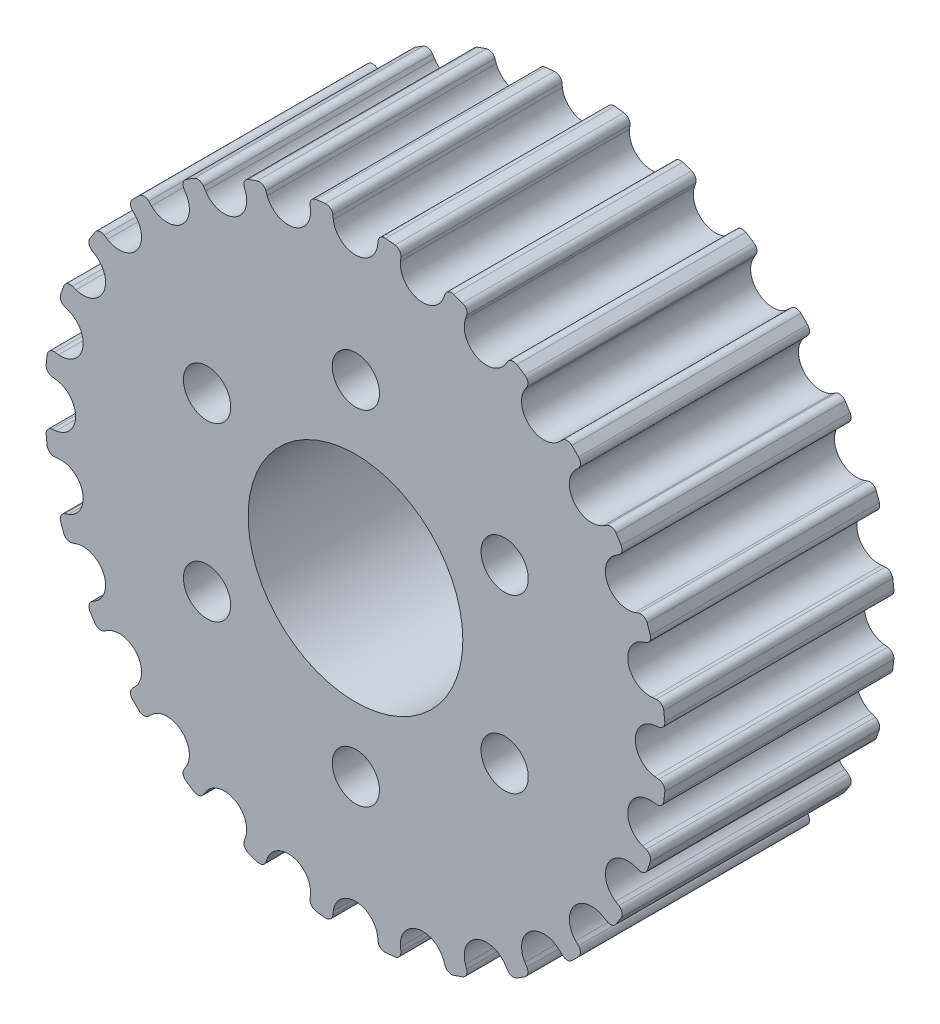
from build123d import *

# Parameters (mm, degrees)
SKETCH_1_R          = 7.5
EXTRUDE_1_DEPTH     = 16
SKETCH_9_R          = 1.65
CUT_EXTRUDE_2_DEPTH = 16
SKETCH_7_R          = 1.65
CUT_EXTRUDE_1_DEPTH = 41


with BuildPart() as part:
    # 草图1 → 凸台-拉伸1 (new body)
    with BuildSketch(Plane.XY):
        with BuildLine():
            Line((1.554033471, 21.184411781), (1.521048557, 20.915771216))
            ThreePointArc((1.521048557, 20.915771216), (-0.027323439, 19.545887392), (-1.575695436, 20.915771216))
            Line((-1.575695436, 20.915771216), (-1.608680349, 21.184411781))
            ThreePointArc((-1.608680349, 21.184411781), (-1.784864491, 21.500423691), (-2.131632272, 21.603653945))
            ThreePointArc((-2.131632272, 21.603653945), (-2.457848286, 21.569392044), (-2.783509374, 21.530205035))
            ThreePointArc((-2.783509374, 21.530205035), (-3.09861207, 21.352399889), (-3.200059642, 21.005106398))
            Line((-3.200059642, 21.005106398), (-3.172439406, 20.735861379))
            ThreePointArc((-3.172439406, 20.735861379), (-4.377162656, 19.055778219), (-6.191541562, 20.046771013))
            Line((-6.191541562, 20.046771013), (-6.283477625, 20.301336364))
            ThreePointArc((-6.283477625, 20.301336364), (-6.525563727, 20.570220536), (-6.886608208, 20.593699501))
            ThreePointArc((-6.886608208, 20.593699501), (-7.197021316, 20.487706726), (-7.505797471, 20.377035808))
            ThreePointArc((-7.505797471, 20.377035808), (-7.773434517, 20.133571662), (-7.795058515, 19.772411335))
            Line((-7.795058515, 19.772411335), (-7.708218122, 19.516062931))
            ThreePointArc((-7.708218122, 19.516062931), (-8.508882771, 17.610026822), (-10.498288052, 18.172436068))
            Line((-10.498288052, 18.172436068), (-10.644565205, 18.400161236))
            ThreePointArc((-10.644565205, 18.400161236), (-10.940414061, 18.608434695), (-11.297630964, 18.550985038))
            ThreePointArc((-11.297630964, 18.550985038), (-11.576675756, 18.378576309), (-11.853083652, 18.201970983))
            ThreePointArc((-11.853083652, 18.201970983), (-12.059834609, 17.905056146), (-12.000550715, 17.54813907))
            Line((-12.000550715, 17.54813907), (-11.858844707, 17.317541662))
            ThreePointArc((-11.858844707, 17.317541662), (-12.215302086, 15.281129211), (-14.279976653, 15.386753363))
            Line((-14.279976653, 15.386753363), (-14.47325995, 15.576219257))
            ThreePointArc((-14.47325995, 15.576219257), (-14.808036462, 15.713438301), (-15.14351344, 15.577940788))
            ThreePointArc((-15.14351344, 15.577940788), (-15.377197445, 15.347761398), (-15.607376836, 15.114077393))
            ThreePointArc((-15.607376836, 15.114077393), (-15.742874348, 14.778600415), (-15.605655304, 14.443823903))
            Line((-15.605655304, 14.443823903), (-15.41618941, 14.250540606))
            ThreePointArc((-15.41618941, 14.250540606), (-15.310565258, 12.185866039), (-17.346977709, 11.829408659))
            Line((-17.346977709, 11.829408659), (-17.577575117, 11.971114668))
            ThreePointArc((-17.577575117, 11.971114668), (-17.934492193, 12.030398562), (-18.23140703, 11.823647605))
            ThreePointArc((-18.23140703, 11.823647605), (-18.408012356, 11.547239709), (-18.580421086, 11.268194917))
            ThreePointArc((-18.580421086, 11.268194917), (-18.637870742, 10.910978014), (-18.429597284, 10.615129158))
            Line((-18.429597284, 10.615129158), (-18.201872116, 10.468852005))
            ThreePointArc((-18.201872116, 10.468852005), (-17.639462869, 8.479446724), (-19.545498979, 7.678782075))
            Line((-19.545498979, 7.678782075), (-19.801847382, 7.765622467))
            ThreePointArc((-19.801847382, 7.765622467), (-20.163007709, 7.74399847), (-20.406471855, 7.476361423))
            ThreePointArc((-20.406471855, 7.476361423), (-20.517142773, 7.167585269), (-20.623135549, 6.857172161))
            ThreePointArc((-20.623135549, 6.857172161), (-20.599656583, 6.49612768), (-20.330772412, 6.254041577))
            Line((-20.330772412, 6.254041577), (-20.07620706, 6.162105515))
            ThreePointArc((-20.07620706, 6.162105515), (-19.085214266, 4.347726609), (-20.765297426, 3.143003359))
            Line((-20.765297426, 3.143003359), (-21.034542445, 3.170623595))
            ThreePointArc((-21.034542445, 3.170623595), (-21.381835936, 3.069176023), (-21.559641082, 2.754073327))
            ThreePointArc((-21.559641082, 2.754073327), (-21.598828091, 2.428412239), (-21.633089992, 2.102196225))
            ThreePointArc((-21.633089992, 2.102196225), (-21.529859738, 1.755428444), (-21.213847828, 1.579244302))
            Line((-21.213847828, 1.579244302), (-20.945207263, 1.546259388))
            ThreePointArc((-20.945207263, 1.546259388), (-19.575323439, -0.002112608), (-20.945207263, -1.550484605))
            Line((-20.945207263, -1.550484605), (-21.213847828, -1.583469519))
            ThreePointArc((-21.213847828, -1.583469519), (-21.529859738, -1.75965366), (-21.633089992, -2.106421441))
            ThreePointArc((-21.633089992, -2.106421441), (-21.598828091, -2.432637455), (-21.559641082, -2.758298543))
            ThreePointArc((-21.559641082, -2.758298543), (-21.381835936, -3.073401239), (-21.034542445, -3.174848812))
            Line((-21.034542445, -3.174848812), (-20.765297426, -3.147228575))
            ThreePointArc((-20.765297426, -3.147228575), (-19.085214266, -4.351951825), (-20.07620706, -6.166330731))
            Line((-20.07620706, -6.166330731), (-20.330772412, -6.258266794))
            ThreePointArc((-20.330772412, -6.258266794), (-20.599656583, -6.500352897), (-20.623135549, -6.861397377))
            ThreePointArc((-20.623135549, -6.861397377), (-20.517142773, -7.171810485), (-20.406471855, -7.48058664))
            ThreePointArc((-20.406471855, -7.48058664), (-20.163007709, -7.748223686), (-19.801847382, -7.769847684))
            Line((-19.801847382, -7.769847684), (-19.545498979, -7.683007291))
            ThreePointArc((-19.545498979, -7.683007291), (-17.639462869, -8.48367194), (-18.201872116, -10.473077221))
            Line((-18.201872116, -10.473077221), (-18.429597284, -10.619354374))
            ThreePointArc((-18.429597284, -10.619354374), (-18.637870742, -10.91520323), (-18.580421086, -11.272420133))
            ThreePointArc((-18.580421086, -11.272420133), (-18.408012356, -11.551464925), (-18.23140703, -11.827872821))
            ThreePointArc((-18.23140703, -11.827872821), (-17.934492193, -12.034623778), (-17.577575117, -11.975339884))
            Line((-17.577575117, -11.975339884), (-17.346977709, -11.833633876))
            ThreePointArc((-17.346977709, -11.833633876), (-15.310565258, -12.190091255), (-15.41618941, -14.254765823))
            Line((-15.41618941, -14.254765823), (-15.605655304, -14.448049119))
            ThreePointArc((-15.605655304, -14.448049119), (-15.742874348, -14.782825631), (-15.607376836, -15.11830261))
            ThreePointArc((-15.607376836, -15.11830261), (-15.377197445, -15.351986614), (-15.14351344, -15.582166005))
            ThreePointArc((-15.14351344, -15.582166005), (-14.808036462, -15.717663517), (-14.47325995, -15.580444473))
            Line((-14.47325995, -15.580444473), (-14.279976653, -15.390978579))
            ThreePointArc((-14.279976653, -15.390978579), (-12.215302086, -15.285354427), (-11.858844707, -17.321766878))
            Line((-11.858844707, -17.321766878), (-12.000550715, -17.552364287))
            ThreePointArc((-12.000550715, -17.552364287), (-12.059834609, -17.909281362), (-11.853083652, -18.206196199))
            ThreePointArc((-11.853083652, -18.206196199), (-11.576675756, -18.382801525), (-11.297630964, -18.555210255))
            ThreePointArc((-11.297630964, -18.555210255), (-10.940414061, -18.612659911), (-10.644565205, -18.404386453))
            Line((-10.644565205, -18.404386453), (-10.498288052, -18.176661285))
            ThreePointArc((-10.498288052, -18.176661285), (-8.508882771, -17.614252038), (-7.708218122, -19.520288148))
            Line((-7.708218122, -19.520288148), (-7.795058515, -19.776636551))
            ThreePointArc((-7.795058515, -19.776636551), (-7.773434517, -20.137796878), (-7.505797471, -20.381261024))
            ThreePointArc((-7.505797471, -20.381261024), (-7.197021316, -20.491931943), (-6.886608208, -20.597924718))
            ThreePointArc((-6.886608208, -20.597924718), (-6.525563727, -20.574445752), (-6.283477625, -20.305561581))
            Line((-6.283477625, -20.305561581), (-6.191541562, -20.050996229))
            ThreePointArc((-6.191541562, -20.050996229), (-4.377162656, -19.060003436), (-3.172439406, -20.740086595))
            Line((-3.172439406, -20.740086595), (-3.200059642, -21.009331614))
            ThreePointArc((-3.200059642, -21.009331614), (-3.09861207, -21.356625105), (-2.783509374, -21.534430251))
            ThreePointArc((-2.783509374, -21.534430251), (-2.457848286, -21.573617261), (-2.131632272, -21.607879161))
            ThreePointArc((-2.131632272, -21.607879161), (-1.784864491, -21.504648907), (-1.608680349, -21.188636997))
            Line((-1.608680349, -21.188636997), (-1.575695436, -20.919996432))
            ThreePointArc((-1.575695436, -20.919996432), (-0.027323439, -19.550112608), (1.521048557, -20.919996432))
            Line((1.521048557, -20.919996432), (1.554033471, -21.188636997))
            ThreePointArc((1.554033471, -21.188636997), (1.730217613, -21.504648907), (2.076985394, -21.607879161))
            ThreePointArc((2.076985394, -21.607879161), (2.403201408, -21.573617261), (2.728862496, -21.534430251))
            ThreePointArc((2.728862496, -21.534430251), (3.043965192, -21.356625105), (3.145412764, -21.009331614))
            Line((3.145412764, -21.009331614), (3.117792528, -20.740086595))
            ThreePointArc((3.117792528, -20.740086595), (4.322515778, -19.060003436), (6.136894684, -20.050996229))
            Line((6.136894684, -20.050996229), (6.228830746, -20.305561581))
            ThreePointArc((6.228830746, -20.305561581), (6.470916849, -20.574445752), (6.83196133, -20.597924718))
            ThreePointArc((6.83196133, -20.597924718), (7.142374438, -20.491931943), (7.451150593, -20.381261024))
            ThreePointArc((7.451150593, -20.381261024), (7.718787639, -20.137796878), (7.740411637, -19.776636551))
            Line((7.740411637, -19.776636551), (7.653571244, -19.520288148))
            ThreePointArc((7.653571244, -19.520288148), (8.454235893, -17.614252038), (10.443641174, -18.176661285))
            Line((10.443641174, -18.176661285), (10.589918327, -18.404386453))
            ThreePointArc((10.589918327, -18.404386453), (10.885767183, -18.612659911), (11.242984086, -18.555210255))
            ThreePointArc((11.242984086, -18.555210255), (11.522028878, -18.382801525), (11.798436774, -18.206196199))
            ThreePointArc((11.798436774, -18.206196199), (12.005187731, -17.909281362), (11.945903837, -17.552364287))
            Line((11.945903837, -17.552364287), (11.804197828, -17.321766878))
            ThreePointArc((11.804197828, -17.321766878), (12.160655208, -15.285354427), (14.225329775, -15.390978579))
            Line((14.225329775, -15.390978579), (14.418613072, -15.580444473))
            ThreePointArc((14.418613072, -15.580444473), (14.753389584, -15.717663517), (15.088866562, -15.582166005))
            ThreePointArc((15.088866562, -15.582166005), (15.322550567, -15.351986614), (15.552729958, -15.11830261))
            ThreePointArc((15.552729958, -15.11830261), (15.68822747, -14.782825631), (15.551008426, -14.448049119))
            Line((15.551008426, -14.448049119), (15.361542532, -14.254765823))
            ThreePointArc((15.361542532, -14.254765823), (15.25591838, -12.190091255), (17.292330831, -11.833633876))
            Line((17.292330831, -11.833633876), (17.522928239, -11.975339884))
            ThreePointArc((17.522928239, -11.975339884), (17.879845315, -12.034623778), (18.176760152, -11.827872821))
            ThreePointArc((18.176760152, -11.827872821), (18.353365478, -11.551464925), (18.525774208, -11.272420133))
            ThreePointArc((18.525774208, -11.272420133), (18.583223864, -10.91520323), (18.374950406, -10.619354374))
            Line((18.374950406, -10.619354374), (18.147225238, -10.473077221))
            ThreePointArc((18.147225238, -10.473077221), (17.584815991, -8.48367194), (19.4908521, -7.683007291))
            Line((19.4908521, -7.683007291), (19.747200504, -7.769847684))
            ThreePointArc((19.747200504, -7.769847684), (20.108360831, -7.748223686), (20.351824977, -7.48058664))
            ThreePointArc((20.351824977, -7.48058664), (20.462495895, -7.171810485), (20.568488671, -6.861397377))
            ThreePointArc((20.568488671, -6.861397377), (20.545009705, -6.500352897), (20.276125534, -6.258266794))
            Line((20.276125534, -6.258266794), (20.021560182, -6.166330731))
            ThreePointArc((20.021560182, -6.166330731), (19.030567388, -4.351951825), (20.710650548, -3.147228575))
            Line((20.710650548, -3.147228575), (20.979895567, -3.174848812))
            ThreePointArc((20.979895567, -3.174848812), (21.327189058, -3.073401239), (21.504994204, -2.758298543))
            ThreePointArc((21.504994204, -2.758298543), (21.544181213, -2.432637455), (21.578443114, -2.106421441))
            ThreePointArc((21.578443114, -2.106421441), (21.47521286, -1.75965366), (21.15920095, -1.583469519))
            Line((21.15920095, -1.583469519), (20.890560385, -1.550484605))
            ThreePointArc((20.890560385, -1.550484605), (19.520676561, -0.002112608), (20.890560385, 1.546259388))
            Line((20.890560385, 1.546259388), (21.15920095, 1.579244302))
            ThreePointArc((21.15920095, 1.579244302), (21.47521286, 1.755428444), (21.578443114, 2.102196225))
            ThreePointArc((21.578443114, 2.102196225), (21.544181213, 2.428412239), (21.504994204, 2.754073327))
            ThreePointArc((21.504994204, 2.754073327), (21.327189058, 3.069176023), (20.979895567, 3.170623595))
            Line((20.979895567, 3.170623595), (20.710650548, 3.143003359))
            ThreePointArc((20.710650548, 3.143003359), (19.030567388, 4.347726609), (20.021560182, 6.162105515))
            Line((20.021560182, 6.162105515), (20.276125534, 6.254041577))
            ThreePointArc((20.276125534, 6.254041577), (20.545009705, 6.49612768), (20.568488671, 6.857172161))
            ThreePointArc((20.568488671, 6.857172161), (20.462495895, 7.167585269), (20.351824977, 7.476361423))
            ThreePointArc((20.351824977, 7.476361423), (20.108360831, 7.74399847), (19.747200504, 7.765622467))
            Line((19.747200504, 7.765622467), (19.4908521, 7.678782075))
            ThreePointArc((19.4908521, 7.678782075), (17.584815991, 8.479446724), (18.147225238, 10.468852005))
            Line((18.147225238, 10.468852005), (18.374950406, 10.615129158))
            ThreePointArc((18.374950406, 10.615129158), (18.583223864, 10.910978014), (18.525774208, 11.268194917))
            ThreePointArc((18.525774208, 11.268194917), (18.353365478, 11.547239709), (18.176760152, 11.823647605))
            ThreePointArc((18.176760152, 11.823647605), (17.879845315, 12.030398562), (17.522928239, 11.971114668))
            Line((17.522928239, 11.971114668), (17.292330831, 11.829408659))
            ThreePointArc((17.292330831, 11.829408659), (15.25591838, 12.185866039), (15.361542532, 14.250540606))
            Line((15.361542532, 14.250540606), (15.551008426, 14.443823903))
            ThreePointArc((15.551008426, 14.443823903), (15.68822747, 14.778600415), (15.552729958, 15.114077393))
            ThreePointArc((15.552729958, 15.114077393), (15.322550567, 15.347761398), (15.088866562, 15.577940788))
            ThreePointArc((15.088866562, 15.577940788), (14.753389584, 15.713438301), (14.418613072, 15.576219257))
            Line((14.418613072, 15.576219257), (14.225329775, 15.386753363))
            ThreePointArc((14.225329775, 15.386753363), (12.160655208, 15.281129211), (11.804197828, 17.317541662))
            Line((11.804197828, 17.317541662), (11.945903837, 17.54813907))
            ThreePointArc((11.945903837, 17.54813907), (12.005187731, 17.905056146), (11.798436774, 18.201970983))
            ThreePointArc((11.798436774, 18.201970983), (11.522028878, 18.378576309), (11.242984086, 18.550985038))
            ThreePointArc((11.242984086, 18.550985038), (10.885767183, 18.608434695), (10.589918327, 18.400161236))
            Line((10.589918327, 18.400161236), (10.443641174, 18.172436068))
            ThreePointArc((10.443641174, 18.172436068), (8.454235893, 17.610026822), (7.653571244, 19.516062931))
            Line((7.653571244, 19.516062931), (7.740411637, 19.772411335))
            ThreePointArc((7.740411637, 19.772411335), (7.718787639, 20.133571662), (7.451150593, 20.377035808))
            ThreePointArc((7.451150593, 20.377035808), (7.142374438, 20.487706726), (6.83196133, 20.593699501))
            ThreePointArc((6.83196133, 20.593699501), (6.470916849, 20.570220536), (6.228830746, 20.301336364))
            Line((6.228830746, 20.301336364), (6.136894684, 20.046771013))
            ThreePointArc((6.136894684, 20.046771013), (4.322515778, 19.055778219), (3.117792528, 20.735861379))
            Line((3.117792528, 20.735861379), (3.145412764, 21.005106398))
            ThreePointArc((3.145412764, 21.005106398), (3.043965192, 21.352399889), (2.728862496, 21.530205035))
            ThreePointArc((2.728862496, 21.530205035), (2.403201408, 21.569392044), (2.076985394, 21.603653945))
            ThreePointArc((2.076985394, 21.603653945), (1.730217613, 21.500423691), (1.554033471, 21.184411781))
        make_face()
        with Locations((-0.027323439, -0.002112608)):
            Circle(SKETCH_1_R, mode=Mode.SUBTRACT)
    extrude(amount=EXTRUDE_1_DEPTH)

    # 草图9 → 切除-拉伸2 (cut)
    with BuildSketch(Plane(origin=(0, 0, 0), x_dir=(-1, 0, 0), z_dir=(0, 0, -1))):
        with Locations((0, 12)):
            Circle(SKETCH_9_R)
        with Locations((10.392304845, 6)):
            Circle(SKETCH_9_R)
        with Locations((10.392304845, -6)):
            Circle(SKETCH_9_R)
        with Locations((0, -12)):
            Circle(SKETCH_9_R)
        with Locations((-10.392304845, -6)):
            Circle(SKETCH_9_R)
        with Locations((-10.392304845, 6)):
            Circle(SKETCH_9_R)
    extrude(amount=-CUT_EXTRUDE_2_DEPTH, mode=Mode.SUBTRACT)

    # 草图7 → 切除-拉伸1 (cut)
    with BuildSketch(Plane(origin=(0, 0, 0), x_dir=(-1, 0, 0), z_dir=(0, 0, -1))):
        with Locations((0, 12)):
            Circle(SKETCH_7_R)
        with Locations((10.392304845, 6)):
            Circle(SKETCH_7_R)
        with Locations((10.392304845, -6)):
            Circle(SKETCH_7_R)
        with Locations((0, -12)):
            Circle(SKETCH_7_R)
        with Locations((-10.392304845, -6)):
            Circle(SKETCH_7_R)
        with Locations((-10.392304845, 6)):
            Circle(SKETCH_7_R)
    extrude(amount=-CUT_EXTRUDE_1_DEPTH, mode=Mode.SUBTRACT)


solid = part.part
